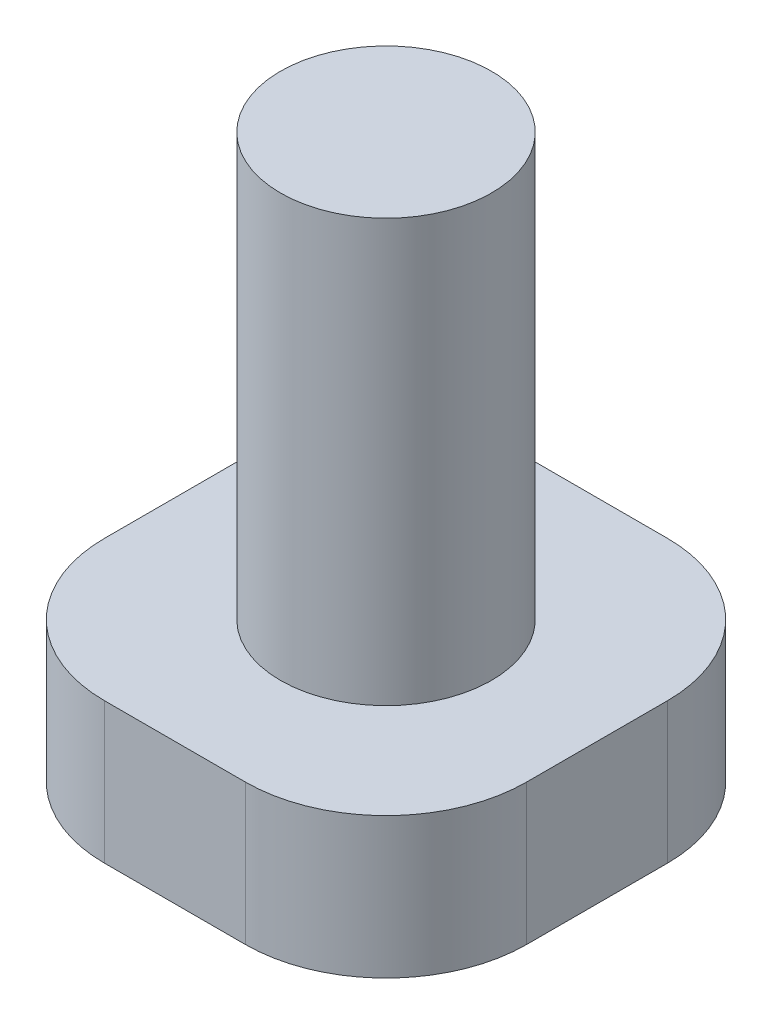
from build123d import *

# Parameters (mm, degrees)
SKETCH1_W           = 7.62
SKETCH1_H           = 7.62
BOSS_EXTRUDE1_DEPTH = 10.16
SKETCH2_W           = 7.62
SKETCH2_H           = 7.62
SKETCH2_R           = 1.905
CUT_EXTRUDE1_DEPTH  = 7.62
FILLET1_R           = 2.54
FILLET2_R           = 2.54
FILLET3_R           = 2.54
FILLET4_R           = 2.54


with BuildPart() as part:
    # Sketch1 → Boss-Extrude1 (new body)
    with BuildSketch(Plane(origin=(0, 0, 0), x_dir=(1, 0, 0), z_dir=(0, 1, 0))):
        with Locations((3.81, 3.81)):
            Rectangle(SKETCH1_W, SKETCH1_H)
    extrude(amount=BOSS_EXTRUDE1_DEPTH)

    # Sketch2 → Cut-Extrude1 (cut)
    with BuildSketch(Plane(origin=(0, 10.16, 0), x_dir=(1, 0, 0), z_dir=(0, 1, 0))):
        with Locations((3.81, 3.81)):
            Rectangle(SKETCH2_W, SKETCH2_H)
        with Locations(Location((3.81, 3.81, 0), (0, 0, 270))):
            Circle(SKETCH2_R, mode=Mode.SUBTRACT)
    extrude(amount=-CUT_EXTRUDE1_DEPTH, mode=Mode.SUBTRACT)

    # Fillet1
    fillet1_edges = [part.edges().sort_by_distance(p)[0] for p in [
        (7.62, 1.27, -7.62),
    ]]
    fillet(fillet1_edges, radius=FILLET1_R)

    # Fillet2
    fillet2_edges = [part.edges().sort_by_distance(p)[0] for p in [
        (0, 1.27, -7.62),
    ]]
    fillet(fillet2_edges, radius=FILLET2_R)

    # Fillet3
    fillet3_edges = [part.edges().sort_by_distance(p)[0] for p in [
        (7.62, 1.27, 0),
    ]]
    fillet(fillet3_edges, radius=FILLET3_R)

    # Fillet4
    fillet4_edges = [part.edges().sort_by_distance(p)[0] for p in [
        (0, 1.27, 0),
    ]]
    fillet(fillet4_edges, radius=FILLET4_R)


solid = part.part
